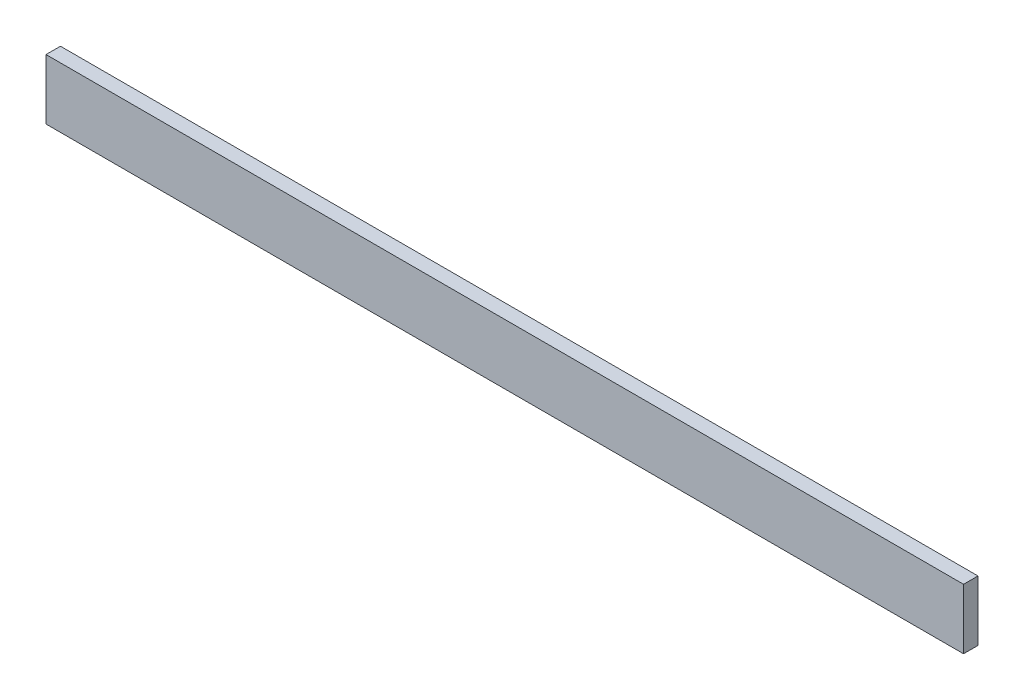
from build123d import *

# Parameters (mm, degrees)
SKETCH1_W           = 152.4
SKETCH1_H           = 10
BOSS_EXTRUDE1_DEPTH = 2.4


with BuildPart() as part:
    # Sketch1 → Boss-Extrude1 (new body)
    with BuildSketch(Plane.XY):
        Rectangle(SKETCH1_W, SKETCH1_H)
    extrude(amount=BOSS_EXTRUDE1_DEPTH)


solid = part.part
